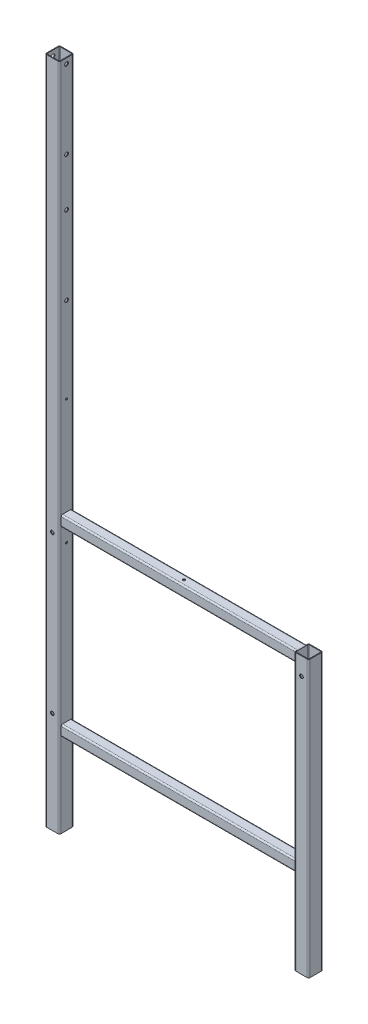
from build123d import *

# Parameters (mm, degrees)
SQUARE_TUBE_CONFIGURED_40_X_40_X_2_1_DEPTH   = 1880
SQUARE_TUBE_CONFIGURED_40_X_40_X_2_1_2_DEPTH = 760
SQUARE_TUBE_CONFIGURED_20_X_20_X_2_1_DEPTH   = 700
SQUARE_TUBE_CONFIGURED_20_X_20_X_2_1_2_DEPTH = 700
BODY_START                                   = 646.86291501
BODY_2_RUN_ON_DEPTH                          = 128.13708499
SKETCH3_W                                    = 5.1
SKETCH3_H                                    = 40
F_10_2_10_2_FRAME_TOGETHER_AT_2_COUNT        = 2
F_10_2_10_2_FRAME_TOGETHER_AT_2_PITCH        = 700
F_10_2_10_2_FRAME_TOGETHER_AT_3_COUNT        = 2
F_10_2_10_2_FRAME_TOGETHER_AT_3_PITCH        = 826.801064344
SKETCH5_W                                    = 5.25
SKETCH5_H                                    = 740
F_10_5_10_5_SHELF_HOLES_AT_2_COUNT           = 2
F_10_5_10_5_SHELF_HOLES_AT_2_PITCH           = 220
F_10_5_10_5_SHELF_HOLES_AT_3_COUNT           = 2
F_10_5_10_5_SHELF_HOLES_AT_3_PITCH           = 355
F_10_5_10_5_SHELF_HOLES_AT_4_COUNT           = 2
F_10_5_10_5_SHELF_HOLES_AT_4_PITCH           = 575
F_5_2_5_2_VERTICAL_WALL_HOLES_AT_2_COUNT     = 2
F_5_2_5_2_VERTICAL_WALL_HOLES_AT_2_PITCH     = 350


with BuildPart() as part:
    # Sketch1 → Square tube - configured 40 X 40 X 2(1) (new body)
    with BuildSketch(Plane(origin=(0, 0, 0), x_dir=(1, 0, 0), z_dir=(0, 1, 0))):
        with BuildLine():
            Line((-16, -20), (16, -20))
            ThreePointArc((16, -20), (18.828427125, -18.828427125), (20, -16))
            Line((20, -16), (20, 16))
            ThreePointArc((20, 16), (18.828427125, 18.828427125), (16, 20))
            Line((16, 20), (-16, 20))
            ThreePointArc((-16, 20), (-18.828427125, 18.828427125), (-20, 16))
            Line((-20, 16), (-20, -16))
            ThreePointArc((-20, -16), (-18.828427125, -18.828427125), (-16, -20))
        make_face()
        with BuildLine():
            Line((-16, -18), (16, -18))
            ThreePointArc((16, -18), (17.414213562, -17.414213562), (18, -16))
            Line((18, -16), (18, 16))
            ThreePointArc((18, 16), (17.414213562, 17.414213562), (16, 18))
            Line((16, 18), (-16, 18))
            ThreePointArc((-16, 18), (-17.414213562, 17.414213562), (-18, 16))
            Line((-18, 16), (-18, -16))
            ThreePointArc((-18, -16), (-17.414213562, -17.414213562), (-16, -18))
        make_face(mode=Mode.SUBTRACT)
    extrude(amount=SQUARE_TUBE_CONFIGURED_40_X_40_X_2_1_DEPTH)


with BuildPart() as body_2:
    # Sketch1 on segment 2 (carried to segment 2) → Square tube - configured 40 X 40 X 2_1 2 (new body)
    with BuildSketch(Plane(origin=(700, 0, 0), x_dir=(1, 0, 0), z_dir=(0, 1, 0))):
        with BuildLine():
            Line((-16, -20), (16, -20))
            ThreePointArc((16, -20), (18.828427125, -18.828427125), (20, -16))
            Line((20, -16), (20, 16))
            ThreePointArc((20, 16), (18.828427125, 18.828427125), (16, 20))
            Line((16, 20), (-16, 20))
            ThreePointArc((-16, 20), (-18.828427125, 18.828427125), (-20, 16))
            Line((-20, 16), (-20, -16))
            ThreePointArc((-20, -16), (-18.828427125, -18.828427125), (-16, -20))
        make_face()
        with BuildLine():
            Line((-16, -18), (16, -18))
            ThreePointArc((16, -18), (17.414213562, -17.414213562), (18, -16))
            Line((18, -16), (18, 16))
            ThreePointArc((18, 16), (17.414213562, 17.414213562), (16, 18))
            Line((16, 18), (-16, 18))
            ThreePointArc((-16, 18), (-17.414213562, 17.414213562), (-18, 16))
            Line((-18, 16), (-18, -16))
            ThreePointArc((-18, -16), (-17.414213562, -17.414213562), (-16, -18))
        make_face(mode=Mode.SUBTRACT)
    extrude(amount=SQUARE_TUBE_CONFIGURED_40_X_40_X_2_1_2_DEPTH)

    # body 2 cut square before the run-on
    split(bisect_by=Plane(origin=(700, 646.86291501, 0), x_dir=(1, 0, 0), z_dir=(0, -1, 0)), keep=Keep.TOP)

    # Sketch1 on segment 2 (carried to segment 2) → body 2 run on (add)
    with BuildSketch(Plane(origin=(700, 0, 0), x_dir=(1, 0, 0), z_dir=(0, 1, 0)).offset(BODY_START)):
        with BuildLine():
            Line((-16, -20), (16, -20))
            ThreePointArc((16, -20), (18.828427125, -18.828427125), (20, -16))
            Line((20, -16), (20, 16))
            ThreePointArc((20, 16), (18.828427125, 18.828427125), (16, 20))
            Line((16, 20), (-16, 20))
            ThreePointArc((-16, 20), (-18.828427125, 18.828427125), (-20, 16))
            Line((-20, 16), (-20, -16))
            ThreePointArc((-20, -16), (-18.828427125, -18.828427125), (-16, -20))
        make_face()
        with BuildLine():
            Line((-16, -18), (16, -18))
            ThreePointArc((16, -18), (17.414213562, -17.414213562), (18, -16))
            Line((18, -16), (18, 16))
            ThreePointArc((18, 16), (17.414213562, 17.414213562), (16, 18))
            Line((16, 18), (-16, 18))
            ThreePointArc((-16, 18), (-17.414213562, 17.414213562), (-18, 16))
            Line((-18, 16), (-18, -16))
            ThreePointArc((-18, -16), (-17.414213562, -17.414213562), (-16, -18))
        make_face(mode=Mode.SUBTRACT)
    extrude(amount=BODY_2_RUN_ON_DEPTH)

    # Sketch3 → Ø10.2 (10.2) Frame Together (revolve, cut)
    with BuildSketch(Plane(origin=(700, 725, 20), x_dir=(0, -1, 0), z_dir=(1, 0, 0))):
        with Locations((2.55, 20)):
            Rectangle(SKETCH3_W, SKETCH3_H)
    f_10_2_10_2_frame_together = revolve(axis=Axis((700, 725, 26.35), (0, 0, -1)), mode=Mode.SUBTRACT)


with BuildPart() as body_3:
    # Sketch11 → Square tube - configured 20 X 20 X 2(1) (new body)
    with BuildSketch(Plane(origin=(700, 760, 0), x_dir=(0, 0, 1), z_dir=(-1, 0, 0))):
        with BuildLine():
            Line((-11, -15), (11, -15))
            ThreePointArc((11, -15), (13.828427125, -13.828427125), (15, -11))
            Line((15, -11), (15, 11))
            ThreePointArc((15, 11), (13.828427125, 13.828427125), (11, 15))
            Line((11, 15), (-11, 15))
            ThreePointArc((-11, 15), (-13.828427125, 13.828427125), (-15, 11))
            Line((-15, 11), (-15, -11))
            ThreePointArc((-15, -11), (-13.828427125, -13.828427125), (-11, -15))
        make_face()
        with BuildLine():
            Line((-11, -13), (11, -13))
            ThreePointArc((11, -13), (12.414213562, -12.414213562), (13, -11))
            Line((13, -11), (13, 11))
            ThreePointArc((13, 11), (12.414213562, 12.414213562), (11, 13))
            Line((11, 13), (-11, 13))
            ThreePointArc((-11, 13), (-12.414213562, 12.414213562), (-13, 11))
            Line((-13, 11), (-13, -11))
            ThreePointArc((-13, -11), (-12.414213562, -12.414213562), (-11, -13))
        make_face(mode=Mode.SUBTRACT)
    extrude(amount=SQUARE_TUBE_CONFIGURED_20_X_20_X_2_1_DEPTH)

    # Trim/Extend1
    split(bisect_by=Plane(origin=(20, 940, 0), x_dir=(0, 1, 0), z_dir=(1, 0, 0)), keep=Keep.TOP)

    # Trim_Extend1 3
    split(bisect_by=Plane(origin=(680, 380, 0), x_dir=(0, -1, 0), z_dir=(-1, 0, 0)), keep=Keep.TOP)

    # Sketch13 → M6 Clearance Hole for table (revolve, cut)
    with BuildSketch(Plane(origin=(350, 775, 0), x_dir=(0, 0, 1), z_dir=(1, 0, 0))):
        Polygon((0, 0), (0, 36.982840043), (3.3, 35), (3.3, 0), align=None)
    revolve(axis=Axis((350, 781.35, 0), (0, -1, 0)), mode=Mode.SUBTRACT)


with BuildPart() as body_4:
    # Sketch11 on segment 2 (carried to segment 2) → Square tube - configured 20 X 20 X 2_1 2 (new body)
    with BuildSketch(Plane(origin=(700, 250, 0), x_dir=(0, 0, 1), z_dir=(-1, 0, 0))):
        with BuildLine():
            Line((-11, -15), (11, -15))
            ThreePointArc((11, -15), (13.828427125, -13.828427125), (15, -11))
            Line((15, -11), (15, 11))
            ThreePointArc((15, 11), (13.828427125, 13.828427125), (11, 15))
            Line((11, 15), (-11, 15))
            ThreePointArc((-11, 15), (-13.828427125, 13.828427125), (-15, 11))
            Line((-15, 11), (-15, -11))
            ThreePointArc((-15, -11), (-13.828427125, -13.828427125), (-11, -15))
        make_face()
        with BuildLine():
            Line((-11, -13), (11, -13))
            ThreePointArc((11, -13), (12.414213562, -12.414213562), (13, -11))
            Line((13, -11), (13, 11))
            ThreePointArc((13, 11), (12.414213562, 12.414213562), (11, 13))
            Line((11, 13), (-11, 13))
            ThreePointArc((-11, 13), (-12.414213562, 12.414213562), (-13, 11))
            Line((-13, 11), (-13, -11))
            ThreePointArc((-13, -11), (-12.414213562, -12.414213562), (-11, -13))
        make_face(mode=Mode.SUBTRACT)
    extrude(amount=SQUARE_TUBE_CONFIGURED_20_X_20_X_2_1_2_DEPTH)

    # Trim/Extend2
    split(bisect_by=Plane(origin=(20, 940, 0), x_dir=(0, 1, 0), z_dir=(1, 0, 0)), keep=Keep.TOP)

    # Trim_Extend2 3
    split(bisect_by=Plane(origin=(680, 380, 0), x_dir=(0, -1, 0), z_dir=(-1, 0, 0)), keep=Keep.TOP)


with BuildPart() as part_1:
    add(part.part)

    # Ø10.2 (10.2) Frame Together at 2: Ø10.2 (10.2) Frame Together ×2
    with Locations(*[(-i * F_10_2_10_2_FRAME_TOGETHER_AT_2_PITCH, 0, 0) for i in range(1, F_10_2_10_2_FRAME_TOGETHER_AT_2_COUNT)]):
        add(f_10_2_10_2_frame_together, mode=Mode.SUBTRACT)

    # Ø10.2 (10.2) Frame Together at 3: Ø10.2 (10.2) Frame Together ×2
    with Locations(*[Vector(-0.8466365492110047, -0.5321715452183461, 0) * (i * F_10_2_10_2_FRAME_TOGETHER_AT_3_PITCH) for i in range(1, F_10_2_10_2_FRAME_TOGETHER_AT_3_COUNT)]):
        add(f_10_2_10_2_frame_together, mode=Mode.SUBTRACT)

    # Sketch5 → Ø10.5 (10.5) Shelf Holes (revolve, cut)
    with BuildSketch(Plane(origin=(-20, 1290, 0), x_dir=(0, 0, 1), z_dir=(0, 1, 0))):
        with Locations((2.625, 370)):
            Rectangle(SKETCH5_W, SKETCH5_H)
    f_10_5_10_5_shelf_holes = revolve(axis=Axis((-26.35, 1290, 0), (1, 0, 0)), mode=Mode.SUBTRACT)

    # Ø10.5 (10.5) Shelf Holes at 2: Ø10.5 (10.5) Shelf Holes ×2
    with Locations(*[(0, i * F_10_5_10_5_SHELF_HOLES_AT_2_PITCH, 0) for i in range(1, F_10_5_10_5_SHELF_HOLES_AT_2_COUNT)]):
        add(f_10_5_10_5_shelf_holes, mode=Mode.SUBTRACT)

    # Ø10.5 (10.5) Shelf Holes at 3: Ø10.5 (10.5) Shelf Holes ×2
    with Locations(*[(0, i * F_10_5_10_5_SHELF_HOLES_AT_3_PITCH, 0) for i in range(1, F_10_5_10_5_SHELF_HOLES_AT_3_COUNT)]):
        add(f_10_5_10_5_shelf_holes, mode=Mode.SUBTRACT)

    # Ø10.5 (10.5) Shelf Holes at 4: Ø10.5 (10.5) Shelf Holes ×2
    with Locations(*[(0, i * F_10_5_10_5_SHELF_HOLES_AT_4_PITCH, 0) for i in range(1, F_10_5_10_5_SHELF_HOLES_AT_4_COUNT)]):
        add(f_10_5_10_5_shelf_holes, mode=Mode.SUBTRACT)

    # Sketch9 → Ø5.2 (5.2) Vertical Wall Holes (revolve, cut)
    with BuildSketch(Plane(origin=(-20, 700, 0), x_dir=(0, 0, 1), z_dir=(0, 1, 0))):
        Polygon((0, 0), (0, 51.562237609), (2.6, 50), (2.6, 0), align=None)
    f_5_2_5_2_vertical_wall_holes = revolve(axis=Axis((-26.35, 700, 0), (1, 0, 0)), mode=Mode.SUBTRACT)

    # Ø5.2 (5.2) Vertical Wall Holes at 2: Ø5.2 (5.2) Vertical Wall Holes ×2
    with Locations(*[(0, i * F_5_2_5_2_VERTICAL_WALL_HOLES_AT_2_PITCH, 0) for i in range(1, F_5_2_5_2_VERTICAL_WALL_HOLES_AT_2_COUNT)]):
        add(f_5_2_5_2_vertical_wall_holes, mode=Mode.SUBTRACT)


solid = Compound([body_2.part, body_3.part, body_4.part, part_1.part])
